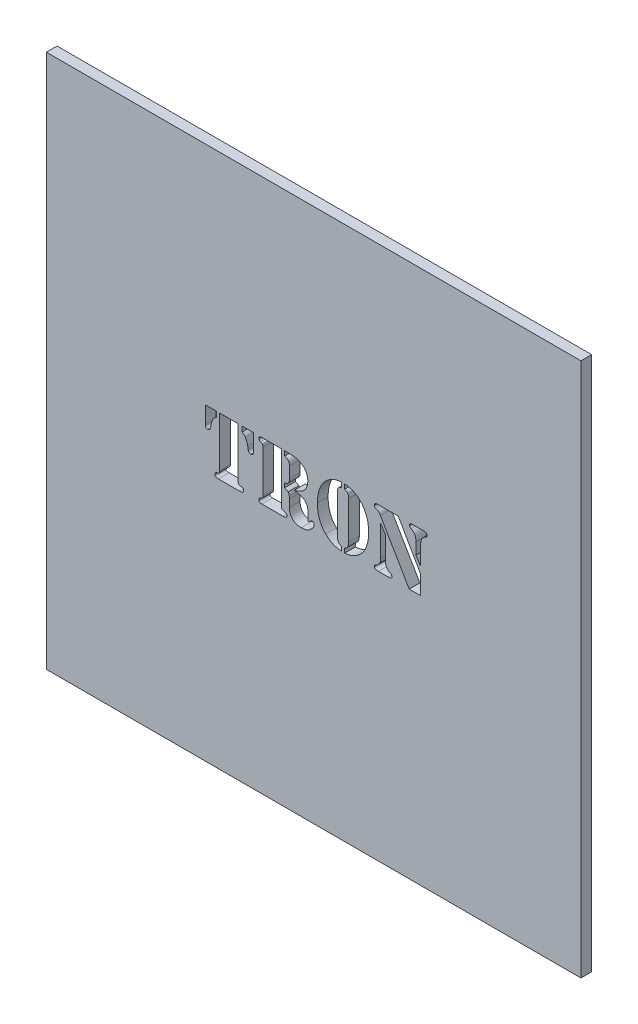
from build123d import *

# Parameters (mm, degrees)
SKETCH_1_W          = 100
SKETCH_1_H          = 100
EXTRUDE_1_DEPTH     = 2
CUT_EXTRUDE_1_DEPTH = 89.987364995


with BuildPart() as part:
    # 草图1 → 凸台-拉伸1 (new body)
    with BuildSketch(Plane.XY):
        with Locations((4.455869751, -20.351328192)):
            Rectangle(SKETCH_1_W, SKETCH_1_H)
    extrude(amount=EXTRUDE_1_DEPTH)

    # 草图2 → 切除-拉伸1 (cut, through all)
    with BuildSketch(Plane.XY.offset(2)):
        with BuildLine():
            Line((-9.674862635, -12.61628828), (-9.674862635, -21.909722688))
            add(Edge.make_bspline(
                [(-9.674862635, -21.909722688), (-9.674454496, -21.957589208), (-9.673697702, -22.046346141), (-9.644621129, -22.16717878), (-9.612338011, -22.272361019), (-9.568900298, -22.325024789), (-9.5484532, -22.349814796)],
                knots=[0, 0, 0, 0, 1.221894812, 2.265709648, 3.183630964, 4, 4, 4, 4], degree=3))
            add(Edge.make_bspline(
                [(-9.5484532, -22.349814796), (-9.527700239, -22.372109409), (-9.490932423, -22.411608553), (-9.429581473, -22.448028325), (-9.363923736, -22.465578803), (-9.281765611, -22.482233558), (-9.168303483, -22.515498058), (-9.080411034, -22.535328508), (-9.031110881, -22.546451695)],
                knots=[0, 0, 0, 0, 0.967781164, 1.714608312, 2.234126727, 3.127399629, 4.388716669, 6, 6, 6, 6], degree=3))
            add(Edge.make_bspline(
                [(-9.031110881, -22.546451695), (-8.970167427, -22.561987676), (-8.858034562, -22.590573092), (-8.722406991, -22.688482318), (-8.638655448, -22.823822569), (-8.630433202, -22.926050243), (-8.626132505, -22.979521057)],
                knots=[0, 0, 0, 0, 1.155259645, 2.125619132, 3.019593567, 4, 4, 4, 4], degree=3))
            add(Edge.make_bspline(
                [(-8.626132505, -22.979521057), (-8.629053133, -23.011875856), (-8.634907964, -23.076735854), (-8.676538964, -23.169706543), (-8.750924646, -23.248087592), (-8.813196647, -23.288294723), (-8.846178559, -23.309590138)],
                knots=[0, 0, 0, 0, 0.931770353, 1.867872026, 2.870733925, 4, 4, 4, 4], degree=3))
            add(Edge.make_bspline(
                [(-8.846178559, -23.309590138), (-8.877030283, -23.323832059), (-8.945929958, -23.355637858), (-9.069501839, -23.384232731), (-9.220359059, -23.39863562), (-9.329930079, -23.401613833), (-9.389270948, -23.403226757)],
                knots=[0, 0, 0, 0, 0.731990245, 1.634718689, 2.719023992, 4, 4, 4, 4], degree=3))
            Line((-9.389270948, -23.403226757), (-9.667839889, -23.403226757))
            Line((-9.667839889, -23.403226757), (-13.12771295, -23.403226757))
            Line((-13.12771295, -23.403226757), (-13.368827244, -23.403226757))
            add(Edge.make_bspline(
                [(-13.368827244, -23.403226757), (-13.418821735, -23.401813775), (-13.512957064, -23.399153252), (-13.645280887, -23.381429902), (-13.759388727, -23.349235877), (-13.854847223, -23.303010839), (-13.930372852, -23.241922533), (-13.980780459, -23.164410773), (-14.016174231, -23.076891769), (-14.018434996, -23.012666685), (-14.019601744, -22.979521057)],
                knots=[0, 0, 0, 0, 1.366783488, 2.573535778, 3.640164188, 4.59418564, 5.457298291, 6.256059838, 7.099977962, 8, 8, 8, 8], degree=3))
            add(Edge.make_bspline(
                [(-14.019601744, -22.979521057), (-14.016817918, -22.926142855), (-14.011546208, -22.825060932), (-13.936445676, -22.693279449), (-13.821770679, -22.591035769), (-13.721998132, -22.562020211), (-13.668464423, -22.546451695)],
                knots=[0, 0, 0, 0, 1.041821617, 1.972890251, 2.912339053, 4, 4, 4, 4], degree=3))
            add(Edge.make_bspline(
                [(-13.668464423, -22.546451695), (-13.625375578, -22.535351904), (-13.549056063, -22.515691812), (-13.452100628, -22.482786616), (-13.3824496, -22.465329875), (-13.326624686, -22.44772138), (-13.274525158, -22.411366933), (-13.246561125, -22.372079777), (-13.230713231, -22.349814796)],
                knots=[0, 0, 0, 0, 1.624637859, 2.877579422, 3.734891967, 4.248647568, 5.007466236, 6, 6, 6, 6], degree=3))
            add(Edge.make_bspline(
                [(-13.230713231, -22.349814796), (-13.212805172, -22.324819874), (-13.174193342, -22.270927953), (-13.146124586, -22.166944333), (-13.123296559, -22.045774188), (-13.12160537, -21.957494264), (-13.120690204, -21.909722688)],
                knots=[0, 0, 0, 0, 0.793417505, 1.710699182, 2.761173524, 4, 4, 4, 4], degree=3))
            Line((-13.120690204, -21.909722688), (-13.120690204, -12.61628828))
            Line((-13.120690204, -12.61628828), (-9.674862635, -12.61628828))
        make_face()
        with BuildLine():
            Line((-6.828309426, -12.61628828), (-6.828309426, -15.870160781))
            add(Edge.make_bspline(
                [(-6.828309426, -15.870160781), (-6.829013844, -15.905513688), (-6.830366219, -15.973385814), (-6.858756217, -16.068605129), (-6.897120003, -16.155692106), (-6.957145762, -16.227483349), (-7.027370238, -16.286959417), (-7.109476269, -16.330282123), (-7.201329604, -16.356063542), (-7.265898003, -16.3598312), (-7.298833435, -16.361753029)],
                knots=[0, 0, 0, 0, 1.105202659, 2.121818522, 3.097439387, 4.073367971, 5.030344682, 5.973096339, 6.966104969, 8, 8, 8, 8], degree=3))
            add(Edge.make_bspline(
                [(-7.298833435, -16.361753029), (-7.331071165, -16.360993584), (-7.393579022, -16.359521047), (-7.481811666, -16.331002883), (-7.563135705, -16.292014476), (-7.658834701, -16.214219511), (-7.753898816, -16.075288532), (-7.785401505, -15.944365943), (-7.802130261, -15.874842612)],
                knots=[0, 0, 0, 0, 0.752729949, 1.459517639, 2.155550537, 2.859009912, 4.332051802, 6, 6, 6, 6], degree=3))
            Line((-7.802130261, -15.874842612), (-7.881721387, -15.394954941))
            add(Edge.make_bspline(
                [(-7.881721387, -15.394954941), (-7.903318734, -15.276495835), (-7.945610653, -15.044529254), (-8.051442263, -14.714775985), (-8.177198619, -14.406599966), (-8.288266039, -14.220185915), (-8.342881734, -14.128519672)],
                knots=[0, 0, 0, 0, 1.063876179, 2.083281991, 3.057483401, 4, 4, 4, 4], degree=3))
            add(Edge.make_bspline(
                [(-8.342881734, -14.128519672), (-8.380797629, -14.075391734), (-8.457218883, -13.968309897), (-8.592908813, -13.822145259), (-8.752324536, -13.69602533), (-8.867362318, -13.622670993), (-8.925769685, -13.585427284)],
                knots=[0, 0, 0, 0, 0.974063882, 1.963271173, 2.965905228, 4, 4, 4, 4], degree=3))
            Line((-8.925769685, -13.585427284), (-8.925769685, -12.61628828))
            Line((-8.925769685, -12.61628828), (-6.828309426, -12.61628828))
        make_face()
        with BuildLine():
            Line((-15.817424823, -12.61628828), (-13.719964564, -12.61628828))
            Line((-13.719964564, -12.61628828), (-13.719964564, -13.585427284))
            add(Edge.make_bspline(
                [(-13.719964564, -13.585427284), (-13.780209436, -13.622291114), (-13.89726761, -13.693918997), (-14.055069183, -13.823191177), (-14.191062832, -13.967527588), (-14.265870555, -14.075260707), (-14.302852515, -14.128519672)],
                knots=[0, 0, 0, 0, 1.052671273, 2.045381983, 3.033714676, 4, 4, 4, 4], degree=3))
            add(Edge.make_bspline(
                [(-14.302852515, -14.128519672), (-14.35746821, -14.220185915), (-14.46853563, -14.406599966), (-14.594291986, -14.714775985), (-14.700123596, -15.044529254), (-14.742415515, -15.276495835), (-14.764012862, -15.394954941)],
                knots=[0, 0, 0, 0, 0.942516599, 1.916718009, 2.936123821, 4, 4, 4, 4], degree=3))
            Line((-14.764012862, -15.394954941), (-14.843603988, -15.874842612))
            add(Edge.make_bspline(
                [(-14.843603988, -15.874842612), (-14.86012933, -15.944497454), (-14.891353446, -16.076108097), (-14.989063342, -16.213929457), (-15.084499029, -16.291302986), (-15.164410604, -16.331591002), (-15.252204525, -16.359419322), (-15.314679858, -16.360958972), (-15.346900814, -16.361753029)],
                knots=[0, 0, 0, 0, 1.669557139, 3.154575889, 3.858713837, 4.539074476, 5.246543951, 6, 6, 6, 6], degree=3))
            add(Edge.make_bspline(
                [(-15.346900814, -16.361753029), (-15.379831008, -16.359827642), (-15.444389139, -16.35605301), (-15.536315909, -16.330321468), (-15.618157452, -16.28681912), (-15.689004319, -16.228332055), (-15.745255358, -16.154183086), (-15.788541635, -16.069779048), (-15.811434961, -15.972743407), (-15.815368322, -15.905380502), (-15.817424823, -15.870160781)],
                knots=[0, 0, 0, 0, 1.035033885, 2.029136333, 2.972926449, 3.930957286, 4.89275004, 5.880170392, 6.891677706, 8, 8, 8, 8], degree=3))
            Line((-15.817424823, -15.870160781), (-15.817424823, -12.61628828))
        make_face()
        with BuildLine():
            Line((-1.584658778, -12.61628828), (-1.584658778, -21.909722688))
            add(Edge.make_bspline(
                [(-1.584658778, -21.909722688), (-1.584250639, -21.957589208), (-1.583493844, -22.046346141), (-1.554417271, -22.16717878), (-1.522134154, -22.272361019), (-1.47869644, -22.325024789), (-1.458249342, -22.349814796)],
                knots=[0, 0, 0, 0, 1.221894812, 2.265709648, 3.183630964, 4, 4, 4, 4], degree=3))
            add(Edge.make_bspline(
                [(-1.458249342, -22.349814796), (-1.437496381, -22.372109409), (-1.400728566, -22.411608553), (-1.339377616, -22.448028325), (-1.273719878, -22.465578803), (-1.191561753, -22.482233558), (-1.078099626, -22.515498058), (-0.990207177, -22.535328508), (-0.940907024, -22.546451695)],
                knots=[0, 0, 0, 0, 0.967781164, 1.714608312, 2.234126727, 3.127399629, 4.388716669, 6, 6, 6, 6], degree=3))
            add(Edge.make_bspline(
                [(-0.940907024, -22.546451695), (-0.879963569, -22.561987676), (-0.767830705, -22.590573092), (-0.632203134, -22.688482318), (-0.548451591, -22.823822569), (-0.540229344, -22.926050243), (-0.535928648, -22.979521057)],
                knots=[0, 0, 0, 0, 1.155259645, 2.125619132, 3.019593567, 4, 4, 4, 4], degree=3))
            add(Edge.make_bspline(
                [(-0.535928648, -22.979521057), (-0.538849275, -23.011875856), (-0.544704107, -23.076735854), (-0.586335107, -23.169706543), (-0.660720788, -23.248087592), (-0.722992789, -23.288294723), (-0.755974702, -23.309590138)],
                knots=[0, 0, 0, 0, 0.931770353, 1.867872026, 2.870733925, 4, 4, 4, 4], degree=3))
            add(Edge.make_bspline(
                [(-0.755974702, -23.309590138), (-0.786834036, -23.323799786), (-0.855062284, -23.355216517), (-0.976885399, -23.384370516), (-1.124704878, -23.398526254), (-1.23192855, -23.401580857), (-1.289703429, -23.403226757)],
                knots=[0, 0, 0, 0, 0.744408225, 1.645844579, 2.731520362, 4, 4, 4, 4], degree=3))
            Line((-1.289703429, -23.403226757), (-1.577636031, -23.403226757))
            Line((-1.577636031, -23.403226757), (-5.037509093, -23.403226757))
            Line((-5.037509093, -23.403226757), (-5.243509654, -23.403226757))
            add(Edge.make_bspline(
                [(-5.243509654, -23.403226757), (-5.284172477, -23.401881273), (-5.360516697, -23.399355135), (-5.468627473, -23.380645786), (-5.563044416, -23.349182616), (-5.641544043, -23.301451214), (-5.705867757, -23.242318407), (-5.746702793, -23.167831702), (-5.774909545, -23.084508962), (-5.777962875, -23.025046007), (-5.779579296, -22.99356655)],
                knots=[0, 0, 0, 0, 1.275809178, 2.395324508, 3.433364274, 4.378530456, 5.262016052, 6.140052186, 7.015350866, 8, 8, 8, 8], degree=3))
            add(Edge.make_bspline(
                [(-5.779579296, -22.99356655), (-5.776394516, -22.943820595), (-5.770404059, -22.850250256), (-5.714208419, -22.722579024), (-5.616001002, -22.625060949), (-5.531557515, -22.588937047), (-5.486964863, -22.56986085)],
                knots=[0, 0, 0, 0, 1.074896783, 2.021841926, 2.955380476, 4, 4, 4, 4], degree=3))
            add(Edge.make_bspline(
                [(-5.486964863, -22.56986085), (-5.450238113, -22.55674877), (-5.386075561, -22.533841638), (-5.303013998, -22.502135282), (-5.244742518, -22.481899871), (-5.197530054, -22.463715071), (-5.154565438, -22.429364685), (-5.132259132, -22.393711526), (-5.119441134, -22.373223951)],
                knots=[0, 0, 0, 0, 1.641128884, 2.867093284, 3.73955991, 4.239698614, 4.988468111, 6, 6, 6, 6], degree=3))
            add(Edge.make_bspline(
                [(-5.119441134, -22.373223951), (-5.105095293, -22.3495244), (-5.074192584, -22.298472653), (-5.048644247, -22.205244499), (-5.031828334, -22.095306302), (-5.030957975, -22.015936286), (-5.030486347, -21.972927406)],
                knots=[0, 0, 0, 0, 0.795728394, 1.714096871, 2.761318972, 4, 4, 4, 4], degree=3))
            Line((-5.030486347, -21.972927406), (-5.030486347, -14.074678617))
            add(Edge.make_bspline(
                [(-5.030486347, -14.074678617), (-5.031058142, -14.030910742), (-5.032124915, -13.949254874), (-5.047963358, -13.836755506), (-5.074757529, -13.741632074), (-5.105147386, -13.6895262), (-5.119441134, -13.66501841)],
                knots=[0, 0, 0, 0, 1.234380862, 2.302932019, 3.201790819, 4, 4, 4, 4], degree=3))
            add(Edge.make_bspline(
                [(-5.119441134, -13.66501841), (-5.132265959, -13.644548835), (-5.154584145, -13.608927002), (-5.197484373, -13.574406833), (-5.245146332, -13.556622935), (-5.302325509, -13.53273441), (-5.386245378, -13.502506885), (-5.450299931, -13.479315425), (-5.486964863, -13.466040595)],
                knots=[0, 0, 0, 0, 1.009569614, 1.75688657, 2.256055053, 3.138468602, 4.362054748, 6, 6, 6, 6], degree=3))
            add(Edge.make_bspline(
                [(-5.486964863, -13.466040595), (-5.531811886, -13.447214546), (-5.617777554, -13.411127561), (-5.713556829, -13.308365874), (-5.770530156, -13.178699557), (-5.776438944, -13.083543799), (-5.779579296, -13.032971233)],
                knots=[0, 0, 0, 0, 1.03007389, 1.974512116, 2.923511095, 4, 4, 4, 4], degree=3))
            add(Edge.make_bspline(
                [(-5.779579296, -13.032971233), (-5.777925049, -13.000734751), (-5.774797533, -12.93978853), (-5.7472598, -12.854610902), (-5.705801327, -12.779596183), (-5.641618506, -12.720235898), (-5.56256004, -12.673226208), (-5.469185338, -12.638106724), (-5.360428443, -12.620401606), (-5.284141807, -12.617717762), (-5.243509654, -12.61628828)],
                knots=[0, 0, 0, 0, 1.002003185, 1.894384998, 2.766311233, 3.643649008, 4.582238159, 5.621343591, 6.733068665, 8, 8, 8, 8], degree=3))
            Line((-5.243509654, -12.61628828), (-5.037509093, -12.61628828))
            Line((-5.037509093, -12.61628828), (-1.584658778, -12.61628828))
        make_face()
        with BuildLine():
            add(Edge.make_bspline(
                [(0.82882507, -18.1431897), (0.94362314, -18.161346799), (1.160452619, -18.195641752), (1.463925497, -18.252443583), (1.72479724, -18.315567591), (2.012580226, -18.401125818), (2.332485668, -18.53020588), (2.556148631, -18.67706571), (2.666443712, -18.749486806)],
                knots=[0, 0, 0, 0, 1.070387477, 2.021737463, 2.842687182, 3.540656321, 4.787222041, 6, 6, 6, 6], degree=3))
            add(Edge.make_bspline(
                [(2.666443712, -18.749486806), (2.719605553, -18.79137866), (2.823939281, -18.873594273), (2.963811957, -19.013332507), (3.083956796, -19.16543759), (3.181194701, -19.330289702), (3.262068266, -19.50039865), (3.318874329, -19.678218214), (3.351922141, -19.860965819), (3.356878096, -19.984580914), (3.359354691, -20.046353975)],
                knots=[0, 0, 0, 0, 1.063508934, 2.087208589, 3.10086014, 4.102411077, 5.090419251, 6.056551131, 7.028817736, 8, 8, 8, 8], degree=3))
            Line((3.359354691, -20.046353975), (3.359354691, -21.673290226))
            add(Edge.make_bspline(
                [(3.359354691, -21.673290226), (3.360104016, -21.707270646), (3.361443538, -21.768015374), (3.394588917, -21.845993833), (3.451774862, -21.899427457), (3.500296284, -21.903118868), (3.525559689, -21.905040857)],
                knots=[0, 0, 0, 0, 1.25316958, 2.240214927, 3.083741524, 4, 4, 4, 4], degree=3))
            add(Edge.make_bspline(
                [(3.525559689, -21.905040857), (3.545495688, -21.903443601), (3.583404988, -21.900406339), (3.639140449, -21.867616459), (3.693150686, -21.808253379), (3.730533432, -21.758738152), (3.752628489, -21.729472197)],
                knots=[0, 0, 0, 0, 0.793163821, 1.508240713, 2.527246652, 4, 4, 4, 4], degree=3))
            add(Edge.make_bspline(
                [(3.752628489, -21.729472197), (3.784935902, -21.688501956), (3.84471689, -21.612691444), (3.945693093, -21.524003267), (4.049065339, -21.465791777), (4.121103429, -21.458868366), (4.15526595, -21.455585087)],
                knots=[0, 0, 0, 0, 1.239338891, 2.293247842, 3.190609362, 4, 4, 4, 4], degree=3))
            add(Edge.make_bspline(
                [(4.15526595, -21.455585087), (4.201513862, -21.463629578), (4.304745033, -21.481585896), (4.424457726, -21.594900662), (4.53560602, -21.719368347), (4.55092366, -21.826014003), (4.55790341, -21.874608956)],
                knots=[0, 0, 0, 0, 0.883750971, 1.972643604, 3.076199701, 4, 4, 4, 4], degree=3))
            add(Edge.make_bspline(
                [(4.55790341, -21.874608956), (4.555029222, -21.917090326), (4.548876075, -22.00803567), (4.498671605, -22.147609273), (4.425777402, -22.300903722), (4.322949047, -22.462521173), (4.202452836, -22.628067964), (4.062060612, -22.786179661), (3.908534526, -22.935512377), (3.796999666, -23.027107108), (3.740923912, -23.073157676)],
                knots=[0, 0, 0, 0, 0.684039768, 1.464412084, 2.371061592, 3.422678441, 4.54826288, 5.672226709, 6.829678518, 8, 8, 8, 8], degree=3))
            add(Edge.make_bspline(
                [(3.740923912, -23.073157676), (3.686299387, -23.114092911), (3.578195283, -23.195105366), (3.403644049, -23.295786803), (3.222178358, -23.377804928), (3.032841949, -23.444572467), (2.831180527, -23.493432167), (2.614395572, -23.528262079), (2.381266278, -23.549241667), (2.220153355, -23.551754577), (2.137396816, -23.553045347)],
                knots=[0, 0, 0, 0, 0.958586899, 1.897081519, 2.824557007, 3.753975125, 4.714066084, 5.736211938, 6.837192826, 8, 8, 8, 8], degree=3))
            add(Edge.make_bspline(
                [(2.137396816, -23.553045347), (2.052301083, -23.551029071), (1.886390919, -23.547097961), (1.644684055, -23.522943117), (1.418089029, -23.474351169), (1.205413656, -23.41238344), (1.006520828, -23.332529475), (0.822724979, -23.233706952), (0.653040856, -23.115956055), (0.4984575, -22.979953475), (0.360092793, -22.827721872), (0.240012793, -22.66038914), (0.138609853, -22.478988258), (0.057417294, -22.282927981), (-0.009752883, -22.074352759), (-0.051946218, -21.850169462), (-0.081708683, -21.61322386), (-0.084857842, -21.45022415), (-0.086472878, -21.366630299)],
                knots=[0, 0, 0, 0, 1.153595696, 2.249152138, 3.286279574, 4.290195379, 5.2486231, 6.185568737, 7.112672992, 8.041946479, 8.970376977, 9.894944029, 10.827701778, 11.780393513, 12.767171116, 13.791820235, 14.867542465, 16, 16, 16, 16], degree=3))
            Line((-0.086472878, -21.366630299), (-0.086472878, -20.046353975))
            add(Edge.make_bspline(
                [(-0.086472878, -20.046353975), (-0.086179097, -19.980805787), (-0.085657959, -19.864529784), (-0.088575382, -19.713941397), (-0.090328375, -19.60935714), (-0.092653058, -19.555540071), (-0.093495625, -19.536034403)],
                knots=[0, 0, 0, 0, 1.541008393, 2.733596474, 3.540999789, 4, 4, 4, 4], degree=3))
            add(Edge.make_bspline(
                [(-0.093495625, -19.536034403), (-0.102450697, -19.485049439), (-0.120078192, -19.384688759), (-0.166400078, -19.241397911), (-0.233159069, -19.110180751), (-0.289847659, -19.032050587), (-0.318223509, -18.992942015)],
                knots=[0, 0, 0, 0, 1.043671736, 2.054401846, 3.02611791, 4, 4, 4, 4], degree=3))
            add(Edge.make_bspline(
                [(-0.318223509, -18.992942015), (-0.359422864, -18.949562408), (-0.442532231, -18.862054928), (-0.601950965, -18.76585178), (-0.785165899, -18.699611472), (-0.91696228, -18.680050675), (-0.985384418, -18.66989568)],
                knots=[0, 0, 0, 0, 0.941602781, 1.899447498, 2.90949743, 4, 4, 4, 4], degree=3))
            Line((-0.985384418, -18.66989568), (-0.985384418, -17.829507027))
            add(Edge.make_bspline(
                [(-0.985384418, -17.829507027), (-0.917974488, -17.818374164), (-0.792028389, -17.797573953), (-0.620832075, -17.748823814), (-0.478322162, -17.690355686), (-0.402464376, -17.635041773), (-0.367382734, -17.609460973)],
                knots=[0, 0, 0, 0, 1.234740256, 2.306940825, 3.217017826, 4, 4, 4, 4], degree=3))
            add(Edge.make_bspline(
                [(-0.367382734, -17.609460973), (-0.318987503, -17.562020044), (-0.224985839, -17.469871992), (-0.150683947, -17.316886706), (-0.11975447, -17.180256256), (-0.096378981, -17.057161342), (-0.090543505, -16.911891252), (-0.087888892, -16.808067309), (-0.086472878, -16.752685912)],
                knots=[0, 0, 0, 0, 1.298654595, 2.522473575, 3.204406075, 3.997887643, 4.93204039, 6, 6, 6, 6], degree=3))
            Line((-0.086472878, -16.752685912), (-0.086472878, -14.622452836))
            add(Edge.make_bspline(
                [(-0.086472878, -14.622452836), (-0.088150676, -14.544239884), (-0.091294309, -14.397694957), (-0.128697273, -14.194057648), (-0.188635772, -14.021358084), (-0.275975356, -13.875783249), (-0.397229304, -13.753771133), (-0.555825114, -13.651361832), (-0.752905337, -13.562979896), (-0.89971972, -13.518146723), (-0.978361671, -13.494131581)],
                knots=[0, 0, 0, 0, 1.179352059, 2.209711511, 3.111386633, 3.925488779, 4.750089348, 5.684409327, 6.759640805, 8, 8, 8, 8], degree=3))
            Line((-0.978361671, -13.494131581), (-0.978361671, -12.61628828))
            Line((-0.978361671, -12.61628828), (-0.774702026, -12.61628828))
            add(Edge.make_bspline(
                [(-0.774702026, -12.61628828), (-0.635015047, -12.617246903), (-0.366515262, -12.619089523), (0.020560622, -12.63137131), (0.375164638, -12.647842608), (0.600256274, -12.669305499), (0.707097466, -12.679492998)],
                knots=[0, 0, 0, 0, 1.129725499, 2.171505574, 3.132093372, 4, 4, 4, 4], degree=3))
            add(Edge.make_bspline(
                [(0.707097466, -12.679492998), (0.855393888, -12.698827809), (1.148356475, -12.737024121), (1.569948683, -12.864819765), (1.969388504, -13.0416541), (2.210477674, -13.202552488), (2.3316928, -13.283449188)],
                knots=[0, 0, 0, 0, 1.022129002, 2.019236548, 3.004109182, 4, 4, 4, 4], degree=3))
            add(Edge.make_bspline(
                [(2.3316928, -13.283449188), (2.413769705, -13.346240877), (2.574825508, -13.469454173), (2.784581589, -13.686119469), (2.964253849, -13.919924009), (3.10816829, -14.176811942), (3.22034335, -14.452205819), (3.30342469, -14.746330304), (3.349818291, -15.061068332), (3.356117625, -15.276980504), (3.359354691, -15.387932194)],
                knots=[0, 0, 0, 0, 1.015444464, 1.992560821, 2.956745928, 3.908907654, 4.87970133, 5.87616604, 6.908616565, 8, 8, 8, 8], degree=3))
            add(Edge.make_bspline(
                [(3.359354691, -15.387932194), (3.356774848, -15.479298266), (3.351732981, -15.657857834), (3.321980168, -15.919854011), (3.267494845, -16.168870446), (3.192976059, -16.405793087), (3.096711418, -16.630744897), (2.976251361, -16.840492482), (2.838240068, -17.040829768), (2.728784875, -17.160425556), (2.673466459, -17.220869006)],
                knots=[0, 0, 0, 0, 1.092241003, 2.134600727, 3.14625558, 4.134420832, 5.099471293, 6.064296376, 7.021699617, 8, 8, 8, 8], degree=3))
            add(Edge.make_bspline(
                [(2.673466459, -17.220869006), (2.624518485, -17.270339261), (2.527099547, -17.368797673), (2.362393751, -17.497739047), (2.187443983, -17.614969123), (1.993140884, -17.72135056), (1.767928681, -17.821339775), (1.49935861, -17.923460715), (1.181392952, -18.032836528), (0.95153017, -18.104783204), (0.82882507, -18.1431897)],
                knots=[0, 0, 0, 0, 0.799442655, 1.591094567, 2.399797001, 3.218932823, 4.134446843, 5.23076361, 6.521729248, 8, 8, 8, 8], degree=3))
        make_face()
        with BuildLine():
            add(Edge.make_bspline(
                [(9.651735469, -13.264721865), (9.587818187, -13.2896548), (9.466864127, -13.336836716), (9.304602307, -13.428986228), (9.17206889, -13.534260485), (9.065246761, -13.654663698), (8.991854536, -13.801042413), (8.938049257, -13.970644474), (8.909626392, -14.170521155), (8.905071585, -14.31259415), (8.902642519, -14.388361289)],
                knots=[0, 0, 0, 0, 1.118377415, 2.116364868, 3.030964595, 3.870538326, 4.719041391, 5.681309848, 6.763448884, 8, 8, 8, 8], degree=3))
            Line((8.902642519, -14.388361289), (8.902642519, -21.436857763))
            add(Edge.make_bspline(
                [(8.902642519, -21.436857763), (8.904099259, -21.543973258), (8.906789767, -21.741808898), (8.945172405, -22.012819575), (8.998622916, -22.237520619), (9.066454596, -22.358604011), (9.096938503, -22.413019514)],
                knots=[0, 0, 0, 0, 1.27427824, 2.353512468, 3.260059993, 4, 4, 4, 4], degree=3))
            add(Edge.make_bspline(
                [(9.096938503, -22.413019514), (9.12582614, -22.450420412), (9.186519876, -22.529000751), (9.314636986, -22.621562576), (9.472340974, -22.696371594), (9.589487347, -22.731464178), (9.651735469, -22.750111341)],
                knots=[0, 0, 0, 0, 0.851726799, 1.789501929, 2.825406619, 4, 4, 4, 4], degree=3))
            Line((9.651735469, -22.750111341), (9.651735469, -23.613909149))
            add(Edge.make_bspline(
                [(9.651735469, -23.613909149), (9.50780765, -23.59920655), (9.223592046, -23.57017319), (8.808587925, -23.484447213), (8.411114166, -23.368049479), (8.03274526, -23.216507111), (7.670518379, -23.036872022), (7.327666341, -22.822311193), (7.00185745, -22.576005785), (6.802751172, -22.388395404), (6.702181979, -22.293632825)],
                knots=[0, 0, 0, 0, 1.051385509, 2.076180753, 3.076110661, 4.059092477, 5.035964268, 6.012044883, 6.995877765, 8, 8, 8, 8], degree=3))
            add(Edge.make_bspline(
                [(6.702181979, -22.293632825), (6.578023597, -22.16214855), (6.330501448, -21.900021501), (6.015555655, -21.45649805), (5.750597285, -20.975945081), (5.531794284, -20.458328608), (5.363816579, -19.901667024), (5.24321733, -19.308548478), (5.169089042, -18.677238434), (5.161220919, -18.244058064), (5.15717777, -18.021462096)],
                knots=[0, 0, 0, 0, 0.929101366, 1.852256478, 2.788058139, 3.746505495, 4.736611211, 5.773063896, 6.855656831, 8, 8, 8, 8], degree=3))
            add(Edge.make_bspline(
                [(5.15717777, -18.021462096), (5.161844022, -17.797272921), (5.170977933, -17.358435879), (5.250531171, -16.71792603), (5.375389693, -16.110239186), (5.552996163, -15.5373933), (5.781719407, -15.001452721), (6.063406417, -14.50784002), (6.386172921, -14.049124445), (6.645367436, -13.783543682), (6.774750359, -13.650972917)],
                knots=[0, 0, 0, 0, 1.123125173, 2.198451065, 3.229210727, 4.228575418, 5.199030772, 6.142910105, 7.072990733, 8, 8, 8, 8], degree=3))
            add(Edge.make_bspline(
                [(6.774750359, -13.650972917), (6.876951433, -13.556277454), (7.078109308, -13.369892545), (7.402554193, -13.126006378), (7.738949744, -12.918676478), (8.088519435, -12.746320025), (8.452627287, -12.607039502), (8.835523617, -12.504408545), (9.236624146, -12.432931551), (9.511781016, -12.413267036), (9.651735469, -12.403264972)],
                knots=[0, 0, 0, 0, 1.041191674, 2.049331728, 3.02892685, 3.991699427, 4.959285675, 5.938654922, 6.951527461, 8, 8, 8, 8], degree=3))
            Line((9.651735469, -12.403264972), (9.651735469, -13.264721865))
        make_face()
        with BuildLine():
            Line((10.251009829, -13.264721865), (10.251009829, -12.403264972))
            add(Edge.make_bspline(
                [(10.251009829, -12.403264972), (10.390980762, -12.413187195), (10.665402961, -12.432640364), (11.066268412, -12.505126596), (11.449516899, -12.606452708), (11.814690823, -12.746986886), (12.165702793, -12.917967361), (12.502486887, -13.126100702), (12.82698876, -13.369867768), (13.028138774, -13.556269107), (13.130335854, -13.650972917)],
                knots=[0, 0, 0, 0, 1.04780179, 2.054284169, 3.038654616, 4.005621862, 4.973010873, 5.95197931, 6.959474417, 8, 8, 8, 8], degree=3))
            add(Edge.make_bspline(
                [(13.130335854, -13.650972917), (13.260227993, -13.785303592), (13.519590493, -14.053528751), (13.84669217, -14.510504569), (14.123747844, -15.00355297), (14.355424787, -15.531926203), (14.529674562, -16.101122892), (14.655638593, -16.706747818), (14.73116131, -17.351615649), (14.740679596, -17.794187783), (14.745567527, -18.021462096)],
                knots=[0, 0, 0, 0, 0.935258746, 1.86748057, 2.805880446, 3.76541513, 4.752258028, 5.782852375, 6.861426953, 8, 8, 8, 8], degree=3))
            add(Edge.make_bspline(
                [(14.745567527, -18.021462096), (14.741531295, -18.244061138), (14.73367663, -18.677247491), (14.659452921, -19.30851512), (14.539192219, -19.901784146), (14.370115426, -20.457628256), (14.15554472, -20.977206415), (13.8866635, -21.455828194), (13.57242505, -21.89940735), (13.326222699, -22.162069789), (13.202904234, -22.293632825)],
                knots=[0, 0, 0, 0, 1.144670239, 2.227572595, 3.264321513, 4.254710215, 5.211875763, 6.149896407, 7.07331537, 8, 8, 8, 8], degree=3))
            add(Edge.make_bspline(
                [(13.202904234, -22.293632825), (13.102484062, -22.389357473), (12.904046062, -22.578516757), (12.576614119, -22.824176065), (12.235354635, -23.042052433), (11.872171979, -23.220803532), (11.494438283, -23.37351694), (11.096020613, -23.485850235), (10.680961622, -23.57351814), (10.395769118, -23.600310011), (10.251009829, -23.613909149)],
                knots=[0, 0, 0, 0, 1.006659813, 1.989237384, 2.967081666, 3.942707027, 4.924434617, 5.92149591, 6.944983577, 8, 8, 8, 8], degree=3))
            Line((10.251009829, -23.613909149), (10.251009829, -22.750111341))
            add(Edge.make_bspline(
                [(10.251009829, -22.750111341), (10.313349377, -22.734374004), (10.425498371, -22.706062499), (10.574381795, -22.635763355), (10.692386546, -22.536926496), (10.752836482, -22.455821936), (10.784738555, -22.413019514)],
                knots=[0, 0, 0, 0, 1.186680144, 2.134840347, 3.015673713, 4, 4, 4, 4], degree=3))
            add(Edge.make_bspline(
                [(10.784738555, -22.413019514), (10.818264286, -22.353170916), (10.889778777, -22.225506525), (10.954116434, -21.997496192), (10.992935147, -21.730865098), (10.997606554, -21.539249795), (11.000102778, -21.436857763)],
                knots=[0, 0, 0, 0, 0.810910452, 1.729771362, 2.786874963, 4, 4, 4, 4], degree=3))
            Line((11.000102778, -21.436857763), (11.000102778, -14.388361289))
            add(Edge.make_bspline(
                [(11.000102778, -14.388361289), (10.998285294, -14.321156797), (10.99482578, -14.193235588), (10.969702868, -14.012473368), (10.927188124, -13.852023015), (10.879932794, -13.758808675), (10.857306935, -13.714177635)],
                knots=[0, 0, 0, 0, 1.157578965, 2.203407792, 3.139791374, 4, 4, 4, 4], degree=3))
            add(Edge.make_bspline(
                [(10.857306935, -13.714177635), (10.824267534, -13.662642798), (10.761055109, -13.564044098), (10.629741321, -13.440230984), (10.456850332, -13.343701462), (10.325181048, -13.293180856), (10.251009829, -13.264721865)],
                knots=[0, 0, 0, 0, 0.947326719, 1.812466874, 2.767730825, 4, 4, 4, 4], degree=3))
        make_face()
        with BuildLine():
            Line((20.281832609, -12.61628828), (24.483775874, -19.936330948))
            Line((24.483775874, -19.936330948), (24.483775874, -23.403226757))
            Line((24.483775874, -23.403226757), (22.327792728, -23.403226757))
            Line((22.327792728, -23.403226757), (16.931982574, -14.156610658))
            add(Edge.make_bspline(
                [(16.931982574, -14.156610658), (16.903964873, -14.110534824), (16.851882894, -14.024884662), (16.779052541, -13.907375721), (16.710062177, -13.814894795), (16.630420117, -13.720900333), (16.518763054, -13.626691508), (16.413131173, -13.585617899), (16.358458285, -13.564359045)],
                knots=[0, 0, 0, 0, 1.148206832, 2.134396517, 2.941784819, 3.601293645, 4.758478929, 6, 6, 6, 6], degree=3))
            Line((16.358458285, -13.564359045), (16.056480189, -13.454336018))
            add(Edge.make_bspline(
                [(16.056480189, -13.454336018), (16.019125252, -13.437884101), (15.94460318, -13.40506298), (15.858906997, -13.314998448), (15.806311878, -13.203300074), (15.798295415, -13.122449911), (15.794297657, -13.082130458)],
                knots=[0, 0, 0, 0, 1.002473422, 1.999906911, 3.00256651, 4, 4, 4, 4], degree=3))
            add(Edge.make_bspline(
                [(15.794297657, -13.082130458), (15.798054124, -13.038605915), (15.805591907, -12.951268932), (15.862013529, -12.83112454), (15.947293657, -12.728358874), (16.02654134, -12.690998801), (16.065843851, -12.672470251)],
                knots=[0, 0, 0, 0, 0.998849935, 2.004306838, 3.010245474, 4, 4, 4, 4], degree=3))
            add(Edge.make_bspline(
                [(16.065843851, -12.672470251), (16.09842881, -12.662881849), (16.182318733, -12.638196524), (16.342955491, -12.629578767), (16.561016853, -12.615000608), (16.726683783, -12.615825524), (16.819618632, -12.61628828)],
                knots=[0, 0, 0, 0, 0.536148819, 1.380314255, 2.53042427, 4, 4, 4, 4], degree=3))
            Line((16.819618632, -12.61628828), (20.281832609, -12.61628828))
        make_face()
        with BuildLine():
            Line((16.992846376, -15.432409588), (17.891757916, -16.81589063))
            Line((17.891757916, -16.81589063), (17.891757916, -21.029538472))
            add(Edge.make_bspline(
                [(17.891757916, -21.029538472), (17.893754839, -21.117070513), (17.897588118, -21.28509644), (17.933359384, -21.524410349), (17.98841995, -21.740361408), (18.068081182, -21.933813753), (18.176777286, -22.105456614), (18.308809218, -22.261835904), (18.469534445, -22.401108081), (18.592102023, -22.477091599), (18.654896359, -22.516019794)],
                knots=[0, 0, 0, 0, 1.190721145, 2.285700438, 3.285246989, 4.21825195, 5.120024924, 6.039327733, 6.995500152, 8, 8, 8, 8], degree=3))
            Line((18.654896359, -22.516019794), (18.888987906, -22.649451976))
            add(Edge.make_bspline(
                [(18.888987906, -22.649451976), (18.920112467, -22.669619678), (18.980384973, -22.708674299), (19.045128666, -22.794547828), (19.084988158, -22.894282402), (19.088492173, -22.965863693), (19.090306636, -23.002930212)],
                knots=[0, 0, 0, 0, 1.033525086, 2.00141443, 2.965084209, 4, 4, 4, 4], degree=3))
            add(Edge.make_bspline(
                [(19.090306636, -23.002930212), (19.088435394, -23.0319853), (19.084815121, -23.0881979), (19.058317003, -23.169462499), (19.009651964, -23.240522895), (18.967070804, -23.279948538), (18.945169877, -23.300226476)],
                knots=[0, 0, 0, 0, 1.017932389, 1.969384057, 2.955585702, 4, 4, 4, 4], degree=3))
            add(Edge.make_bspline(
                [(18.945169877, -23.300226476), (18.92001417, -23.316347441), (18.861827401, -23.35363627), (18.746794042, -23.381662001), (18.602507006, -23.399746426), (18.49582127, -23.40199244), (18.43719122, -23.403226757)],
                knots=[0, 0, 0, 0, 0.677978509, 1.568207904, 2.663588058, 4, 4, 4, 4], degree=3))
            Line((18.43719122, -23.403226757), (16.550413353, -23.403226757))
            add(Edge.make_bspline(
                [(16.550413353, -23.403226757), (16.491055422, -23.401871907), (16.380587584, -23.399350468), (16.225872028, -23.381376948), (16.094768172, -23.350041866), (15.98658186, -23.304919893), (15.898758611, -23.250163814), (15.837281332, -23.176261252), (15.800382096, -23.088814086), (15.796364225, -23.02591719), (15.794297657, -22.99356655)],
                knots=[0, 0, 0, 0, 1.481402756, 2.756958638, 3.881237287, 4.832623133, 5.67532584, 6.435925958, 7.195527913, 8, 8, 8, 8], degree=3))
            add(Edge.make_bspline(
                [(15.794297657, -22.99356655), (15.7966766, -22.950316345), (15.801148238, -22.86902008), (15.859408627, -22.779888942), (15.925085727, -22.717573184), (16.002285806, -22.669045522), (16.096948983, -22.606362748), (16.170750013, -22.56758844), (16.21098061, -22.546451695)],
                knots=[0, 0, 0, 0, 1.181703852, 2.22121744, 2.84898449, 3.689607338, 4.740553118, 6, 6, 6, 6], degree=3))
            add(Edge.make_bspline(
                [(16.21098061, -22.546451695), (16.273067469, -22.510018693), (16.395395415, -22.4382358), (16.556706498, -22.299783331), (16.692664839, -22.139883082), (16.805348527, -21.958931115), (16.888142298, -21.755736798), (16.949327108, -21.532643431), (16.987357204, -21.288334172), (16.990973112, -21.117856456), (16.992846376, -21.029538472)],
                knots=[0, 0, 0, 0, 0.957876818, 1.887277031, 2.816677243, 3.745902915, 4.715393506, 5.729584291, 6.823784461, 8, 8, 8, 8], degree=3))
            Line((16.992846376, -21.029538472), (16.992846376, -15.432409588))
        make_face()
        with BuildLine():
            Line((24.483775874, -18.679259342), (23.584864334, -17.27002823))
            Line((23.584864334, -17.27002823), (23.584864334, -15.088295014))
            add(Edge.make_bspline(
                [(23.584864334, -15.088295014), (23.583147758, -14.982047558), (23.579929184, -14.782834039), (23.542806688, -14.503123814), (23.481654697, -14.263281845), (23.393060364, -14.056025416), (23.268547202, -13.878278518), (23.11037864, -13.716589828), (22.913932379, -13.568842716), (22.764345743, -13.486030388), (22.685952795, -13.44263144)],
                knots=[0, 0, 0, 0, 1.271815313, 2.384648193, 3.370695924, 4.228477648, 5.068356943, 5.953941433, 6.927734667, 8, 8, 8, 8], degree=3))
            add(Edge.make_bspline(
                [(22.685952795, -13.44263144), (22.636153493, -13.417843361), (22.548267394, -13.374097214), (22.443866198, -13.27990773), (22.394840411, -13.160308747), (22.389266604, -13.077051067), (22.386315615, -13.032971233)],
                knots=[0, 0, 0, 0, 1.226241823, 2.164078746, 3.027992319, 4, 4, 4, 4], degree=3))
            add(Edge.make_bspline(
                [(22.386315615, -13.032971233), (22.387872808, -12.999193037), (22.390832564, -12.934990828), (22.419356926, -12.846508247), (22.46597499, -12.772338417), (22.531573088, -12.711700149), (22.619039477, -12.66740139), (22.727284113, -12.638216765), (22.85624053, -12.620120386), (22.949627918, -12.617624689), (22.999635467, -12.61628828)],
                knots=[0, 0, 0, 0, 0.955472393, 1.816066146, 2.601729087, 3.415848399, 4.316465065, 5.352792599, 6.582460055, 8, 8, 8, 8], degree=3))
            Line((22.999635467, -12.61628828), (25.036231925, -12.61628828))
            add(Edge.make_bspline(
                [(25.036231925, -12.61628828), (25.096549219, -12.61668616), (25.206154759, -12.617409167), (25.352460729, -12.644642608), (25.470669303, -12.678704188), (25.526428684, -12.724615096), (25.551233327, -12.745038631)],
                knots=[0, 0, 0, 0, 1.33001182, 2.416830264, 3.295724593, 4, 4, 4, 4], degree=3))
            add(Edge.make_bspline(
                [(25.551233327, -12.745038631), (25.571910858, -12.766816593), (25.611681939, -12.808704239), (25.651467296, -12.884943426), (25.67962799, -12.964643222), (25.681422482, -13.021017609), (25.682324594, -13.049357642)],
                knots=[0, 0, 0, 0, 1.052575171, 2.024518947, 3.006903635, 4, 4, 4, 4], degree=3))
            add(Edge.make_bspline(
                [(25.682324594, -13.049357642), (25.680052321, -13.099324312), (25.675955243, -13.189417962), (25.622291721, -13.292459216), (25.553550306, -13.355564745), (25.474983391, -13.406011626), (25.374729785, -13.469048523), (25.296436419, -13.509583146), (25.253937063, -13.531586228)],
                knots=[0, 0, 0, 0, 1.290521724, 2.326907359, 2.91622468, 3.705360723, 4.754419484, 6, 6, 6, 6], degree=3))
            add(Edge.make_bspline(
                [(25.253937063, -13.531586228), (25.187318089, -13.569621837), (25.055225417, -13.645039169), (24.888883909, -13.804060251), (24.739012747, -13.983520547), (24.667656242, -14.124490208), (24.631253549, -14.196406221)],
                knots=[0, 0, 0, 0, 0.989285188, 1.961563128, 2.960086498, 4, 4, 4, 4], degree=3))
            add(Edge.make_bspline(
                [(24.631253549, -14.196406221), (24.60753941, -14.255925981), (24.557485219, -14.381556245), (24.517592224, -14.593039546), (24.487904011, -14.830707741), (24.485203481, -14.999215253), (24.483775874, -15.088295014)],
                knots=[0, 0, 0, 0, 0.843106883, 1.779572689, 2.826193964, 4, 4, 4, 4], degree=3))
            Line((24.483775874, -15.088295014), (24.483775874, -18.679259342))
        make_face()
    extrude(amount=-CUT_EXTRUDE_1_DEPTH, mode=Mode.SUBTRACT)


solid = part.part
